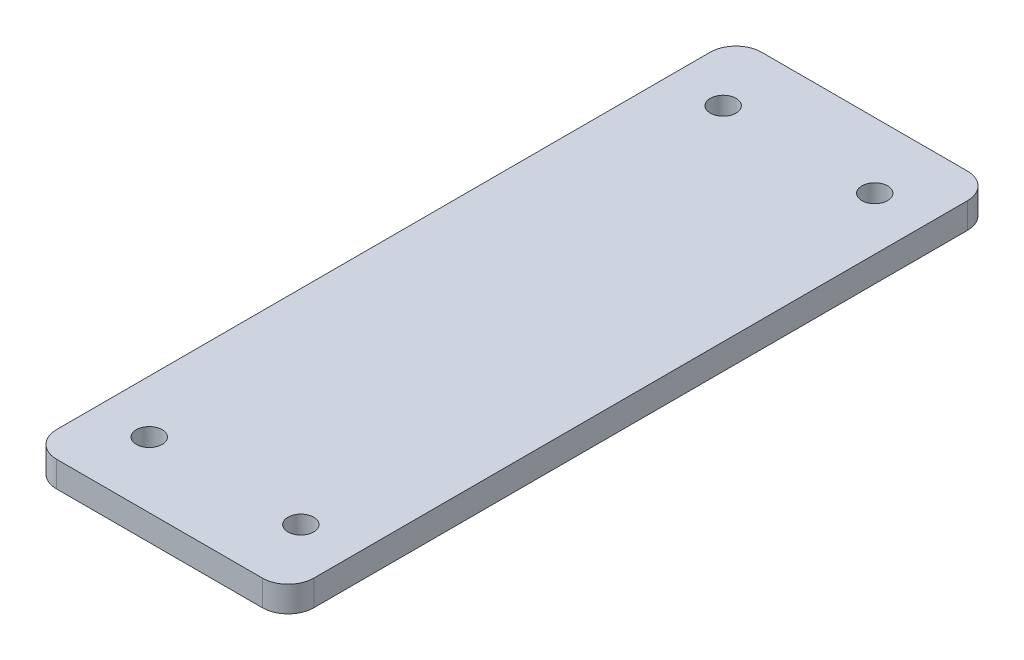
from build123d import *

# Parameters (mm, degrees)
SKETCH1_R           = 1.5
BOSS_EXTRUDE1_DEPTH = 3


with BuildPart() as part:
    # Sketch1 → Boss-Extrude1 (new body)
    with BuildSketch(Plane(origin=(0, 0, 0), x_dir=(1, 0, 0), z_dir=(0, 1, 0))):
        with BuildLine():
            Line((-12, -41.108016468), (12, -41.108016468))
            ThreePointArc((12, -41.108016468), (14.121320344, -40.229336812), (15, -38.108016468))
            Line((15, -38.108016468), (15, 38.108016468))
            ThreePointArc((15, 38.108016468), (14.121320344, 40.229336812), (12, 41.108016468))
            Line((12, 41.108016468), (-12, 41.108016468))
            ThreePointArc((-12, 41.108016468), (-14.121320344, 40.229336812), (-15, 38.108016468))
            Line((-15, 38.108016468), (-15, -38.108016468))
            ThreePointArc((-15, -38.108016468), (-14.121320344, -40.229336812), (-12, -41.108016468))
        make_face()
        with Locations(Location((-8.838834765, 33.462792438, 0), (0, 0, 270))):
            Circle(SKETCH1_R, mode=Mode.SUBTRACT)
        with Locations(Location((8.838834765, 33.462792438, 0), (0, 0, 90))):
            Circle(SKETCH1_R, mode=Mode.SUBTRACT)
        with Locations(Location((8.838834765, -33.462792438, 0), (0, 0, 270))):
            Circle(SKETCH1_R, mode=Mode.SUBTRACT)
        with Locations(Location((-8.838834765, -33.462792438, 0), (0, 0, 90))):
            Circle(SKETCH1_R, mode=Mode.SUBTRACT)
    extrude(amount=BOSS_EXTRUDE1_DEPTH)


solid = part.part
